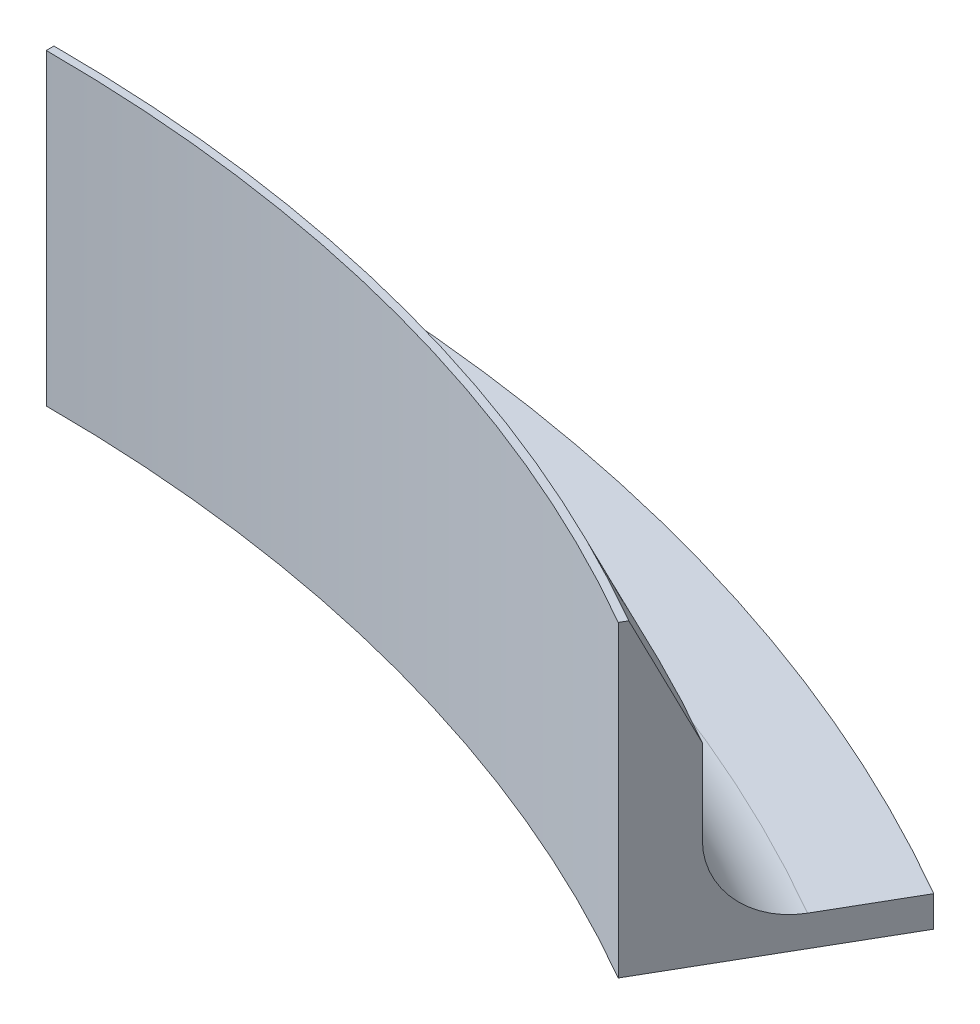
from build123d import *

# Parameters (mm, degrees)
BOSS_EXTRUDE1_DEPTH = 2
BOSS_EXTRUDE2_DEPTH = 20
FILLET1_R           = 5
CHAMFER1_SIZE       = 3.5
CHAMFER1_SIZE2      = 7.505774222


with BuildPart() as part:
    # Sketch1 → Boss-Extrude1 (new body)
    with BuildSketch(Plane(origin=(0, 0, 0), x_dir=(1, 0, 0), z_dir=(0, 1, 0))):
        with BuildLine():
            ThreePointArc((58.25, 100.891959541), (30.152418754, 112.530358763), (0, 116.5))
            Line((0, 116.5), (0, 105.5))
            ThreePointArc((0, 105.5), (27.305409258, 101.905174673), (52.75, 91.365680099))
            Line((52.75, 91.365680099), (58.25, 100.891959541))
        make_face()
    extrude(amount=BOSS_EXTRUDE1_DEPTH)

    # Sketch1<3> → Boss-Extrude2 (add)
    with BuildSketch(Plane(origin=(0, 0, 0), x_dir=(1, 0, 0), z_dir=(0, 1, 0))):
        with BuildLine():
            ThreePointArc((52.75, 91.365680099), (27.305409258, 101.905174673), (0, 105.5))
            Line((0, 105.5), (0, 101.5))
            ThreePointArc((0, 101.5), (26.270133078, 98.041471368), (50.75, 87.901578484))
            Line((50.75, 87.901578484), (52.75, 91.365680099))
        make_face()
    extrude(amount=BOSS_EXTRUDE2_DEPTH)

    # Fillet1
    fillet1_edges = [part.edges().sort_by_distance(p)[0] for p in [
        (27.305409258, 2, -101.905174673),
    ]]
    fillet(fillet1_edges, radius=FILLET1_R)

    # Chamfer1
    chamfer1_edges = [part.edges().sort_by_distance(p)[0] for p in [
        (27.305409258, 20, -101.905174673),
    ]]
    chamfer1_side = [part.faces().sort_by_distance(p)[0] for p in [
        (26.486113557, 20, -98.847521491),
    ]]
    chamfer(chamfer1_edges, length=CHAMFER1_SIZE, length2=CHAMFER1_SIZE2, reference=chamfer1_side[0])


solid = part.part
